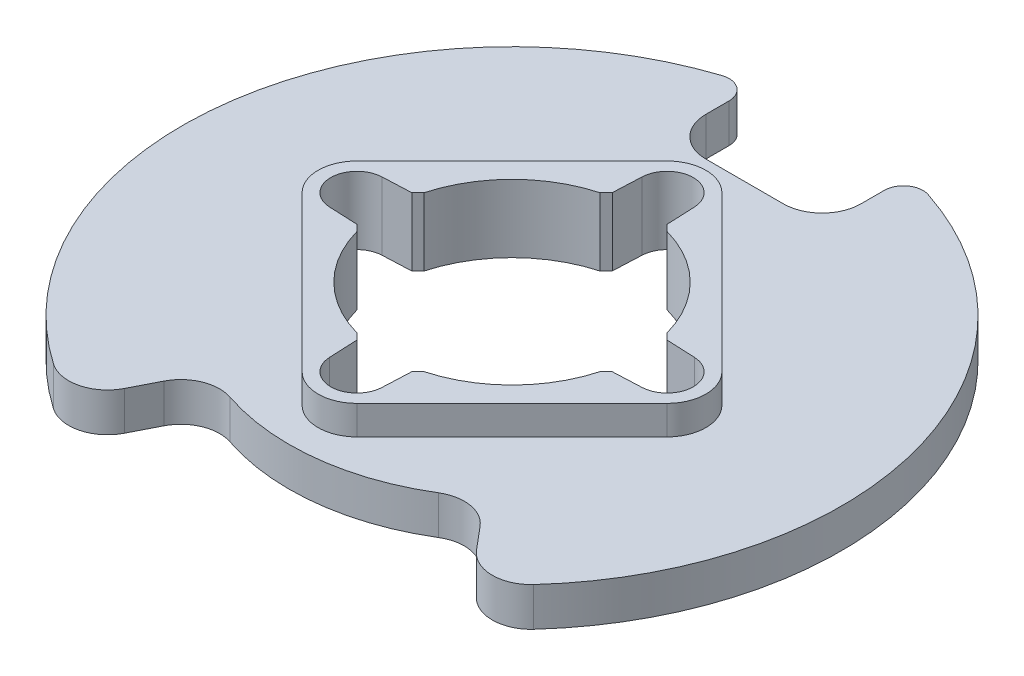
from build123d import *

# Parameters (mm, degrees)
SKETCH_1_R               = 2
SKETCH_1_R_2             = 1.35
EXTRUDE_1_DEPTH          = 1.5
EXTRUDE_1_2_DEPTH        = 1.5
EXTRUDE_1_3_DEPTH        = 1.5
EXTRUDE_1_4_DEPTH        = 1.5
EXTRUDE_3_DEPTH          = 1.5
SKETCH_5_R               = 6.5
CUT_EXTRUDE_1_DEPTH      = 15.221462653
EXTRUDE_START            = 2
SKETCH_4_R               = 17
SKETCH_4_R_2             = 6.5
EXTRUDE_4_DEPTH          = 2
CUT_EXTRUDE_4_DEPTH      = 25.124676164
CUT_EXTRUDE_4_DEPTH_BACK = 25.124676164
SKETCH_8_R               = 1.35
SKETCH_6_W               = 8
SKETCH_6_H               = 5
CUT_EXTRUDE_2_DEPTH      = 25.124676164
CUT_EXTRUDE_3_DEPTH      = 25.124676164
CUT_EXTRUDE_5_DEPTH      = 24.963513933
FILLET_1_R               = 2
FILLET_2_R               = 1


with BuildPart() as part:
    # 草图1 → 凸台-拉伸1 (new body)
    with BuildSketch(Plane(origin=(0, 0, 0), x_dir=(1, 0, 0), z_dir=(0, 1, 0))):
        with Locations(Location((0, 8, 0), (0, 0, 270))):
            Circle(SKETCH_1_R)
        with Locations(Location((0, 8, 0), (0, 0, 270))):
            Circle(SKETCH_1_R_2, mode=Mode.SUBTRACT)
    extrude(amount=EXTRUDE_1_DEPTH)



with BuildPart() as body_2:
    # 草图1 → Extrude 1 2 (new body)
    with BuildSketch(Plane(origin=(0, 0, 0), x_dir=(1, 0, 0), z_dir=(0, 1, 0))):
        with Locations(Location((8, 0, 0), (0, 0, 270))):
            Circle(SKETCH_1_R)
        with Locations(Location((8, 0, 0), (0, 0, 270))):
            Circle(SKETCH_1_R_2, mode=Mode.SUBTRACT)
    extrude(amount=EXTRUDE_1_2_DEPTH)


with BuildPart() as body_3:
    # 草图1 → Extrude 1 3 (new body)
    with BuildSketch(Plane(origin=(0, 0, 0), x_dir=(1, 0, 0), z_dir=(0, 1, 0))):
        with Locations(Location((0, -8, 0), (0, 0, 270))):
            Circle(SKETCH_1_R)
        with Locations(Location((0, -8, 0), (0, 0, 270))):
            Circle(SKETCH_1_R_2, mode=Mode.SUBTRACT)
    extrude(amount=EXTRUDE_1_3_DEPTH)


with BuildPart() as body_4:
    # 草图1 → Extrude 1 4 (new body)
    with BuildSketch(Plane(origin=(0, 0, 0), x_dir=(1, 0, 0), z_dir=(0, 1, 0))):
        with Locations(Location((-8, 0, 0), (0, 0, 270))):
            Circle(SKETCH_1_R)
        with Locations(Location((-8, 0, 0), (0, 0, 270))):
            Circle(SKETCH_1_R_2, mode=Mode.SUBTRACT)
    extrude(amount=EXTRUDE_1_4_DEPTH)


with BuildPart() as part_1:
    add(part.part)

    add(body_2.part)  # 凸台-拉伸3 merges body 2

    add(body_3.part)  # 凸台-拉伸3 merges body 3

    add(body_4.part)  # 凸台-拉伸3 merges body 4
    # 草图3 → 凸台-拉伸3 (add)
    with BuildSketch(Plane.XZ):
        with BuildLine():
            ThreePointArc((-1.414213562, -9.414213562), (-2, -8), (-1.414213562, -6.585786438))
            Line((-1.414213562, -6.585786438), (-6.585786438, -1.414213562))
            ThreePointArc((-6.585786438, -1.414213562), (-8, -2), (-9.414213562, -1.414213562))
            Line((-9.414213562, -1.414213562), (-1.414213562, -9.414213562))
        make_face()
        with BuildLine():
            Line((-1.414213562, 9.414213562), (-9.414213562, 1.414213562))
            ThreePointArc((-9.414213562, 1.414213562), (-8, 2), (-6.585786438, 1.414213562))
            Line((-6.585786438, 1.414213562), (-1.414213562, 6.585786438))
            ThreePointArc((-1.414213562, 6.585786438), (-2, 8), (-1.414213562, 9.414213562))
        make_face()
        with BuildLine():
            ThreePointArc((9.414213562, 1.414213562), (8, 2), (6.585786438, 1.414213562))
            Line((6.585786438, 1.414213562), (1.414213562, 6.585786438))
            ThreePointArc((1.414213562, 6.585786438), (2, 8), (1.414213562, 9.414213562))
            Line((1.414213562, 9.414213562), (9.414213562, 1.414213562))
        make_face()
        with BuildLine():
            ThreePointArc((1.414213562, -9.414213562), (2, -8), (1.414213562, -6.585786438))
            Line((1.414213562, -6.585786438), (6.585786438, -1.414213562))
            ThreePointArc((6.585786438, -1.414213562), (8, -2), (9.414213562, -1.414213562))
            Line((9.414213562, -1.414213562), (1.414213562, -9.414213562))
        make_face()
    extrude(amount=-EXTRUDE_3_DEPTH)

    # 草图5 → 切除-拉伸1 (cut, through all)
    with BuildSketch(Plane.XZ):
        Circle(SKETCH_5_R)
    extrude(amount=-CUT_EXTRUDE_1_DEPTH, mode=Mode.SUBTRACT)

    # 草图4 → 凸台-拉伸4 (add)
    with BuildSketch(Plane.XZ.offset(EXTRUDE_START)):
        with Locations(Location((0, 0, 0), (0, 0, 270))):
            Circle(SKETCH_4_R)
        with Locations(Location((0, 0, 0), (0, 0, 270))):
            Circle(SKETCH_4_R_2, mode=Mode.SUBTRACT)
    extrude(amount=-EXTRUDE_4_DEPTH)

    # 草图8 → 切除-拉伸4 (cut, two sides: drawn at the far end of the back side and taken through both)
    with BuildSketch(Plane(origin=(0, 0, 0), x_dir=(1, 0, 0), z_dir=(0, 1, 0)).offset(-CUT_EXTRUDE_4_DEPTH_BACK)):
        with Locations(Location((8, 0, 0), (0, 0, 270))):
            Circle(SKETCH_8_R)
        with Locations(Location((0, -8, 0), (0, 0, 270))):
            Circle(SKETCH_8_R)
        with Locations(Location((-8, 0, 0), (0, 0, 270))):
            Circle(SKETCH_8_R)
        with Locations(Location((0, 8, 0), (0, 0, 270))):
            Circle(SKETCH_8_R)
    extrude(amount=CUT_EXTRUDE_4_DEPTH + CUT_EXTRUDE_4_DEPTH_BACK, mode=Mode.SUBTRACT)

    # 草图6 → 切除-拉伸2 (cut, through all)
    with BuildSketch(Plane(origin=(0, 0, 0), x_dir=(1, 0, 0), z_dir=(0, 1, 0))):
        with Locations((0, 14.5)):
            Rectangle(SKETCH_6_W, SKETCH_6_H)
    extrude(amount=-CUT_EXTRUDE_2_DEPTH, mode=Mode.SUBTRACT)

    # 草图7 → 切除-拉伸3 (cut, through all)
    with BuildSketch(Plane(origin=(0, 0, 0), x_dir=(1, 0, 0), z_dir=(0, 1, 0))):
        with BuildLine():
            Line((7.392057511, -8.809511096), (10.927389365, -13.022755533))
            ThreePointArc((10.927389365, -13.022755533), (1.924454634, -16.890721547), (-7.717838496, -15.147110911))
            Line((-7.717838496, -15.147110911), (-5.220890747, -10.246575028))
            ThreePointArc((-5.220890747, -10.246575028), (1.301836958, -11.42607634), (7.392057511, -8.809511096))
        make_face()
    extrude(amount=-CUT_EXTRUDE_3_DEPTH, mode=Mode.SUBTRACT)

    # 草图11 → 切除-拉伸5 (cut, through all)
    with BuildSketch(Plane(origin=(0, 1.5, 0), x_dir=(1, 0, 0), z_dir=(0, 1, 0))):
        with BuildLine():
            Line((-8.059965436, 1.348667545), (-6.585786438, 1.414213562))
            Line((-6.585786438, 1.414213562), (-6.263846285, 1.736153715))
            ThreePointArc((-6.263846285, 1.736153715), (-4.596194078, 4.596194078), (-1.736153715, 6.263846285))
            Line((-1.736153715, 6.263846285), (-1.414213562, 6.585786438))
            Line((-1.414213562, 6.585786438), (-1.348667545, 8.059965436))
            ThreePointArc((-1.348667545, 8.059965436), (0, 9.35), (1.348667545, 8.059965436))
            Line((1.348667545, 8.059965436), (1.414213562, 6.585786438))
            Line((1.414213562, 6.585786438), (1.736153715, 6.263846285))
            ThreePointArc((1.736153715, 6.263846285), (4.596194078, 4.596194078), (6.263846285, 1.736153715))
            Line((6.263846285, 1.736153715), (6.585786438, 1.414213562))
            Line((6.585786438, 1.414213562), (8.059965436, 1.348667545))
            ThreePointArc((8.059965436, 1.348667545), (9.35, 0), (8.059965436, -1.348667545))
            Line((8.059965436, -1.348667545), (6.585786438, -1.414213562))
            Line((6.585786438, -1.414213562), (6.263846285, -1.736153715))
            ThreePointArc((6.263846285, -1.736153715), (4.596194078, -4.596194078), (1.736153715, -6.263846285))
            Line((1.736153715, -6.263846285), (1.414213562, -6.585786438))
            Line((1.414213562, -6.585786438), (1.348667545, -8.059965436))
            ThreePointArc((1.348667545, -8.059965436), (0, -9.35), (-1.348667545, -8.059965436))
            Line((-1.348667545, -8.059965436), (-1.414213562, -6.585786438))
            Line((-1.414213562, -6.585786438), (-1.736153715, -6.263846285))
            ThreePointArc((-1.736153715, -6.263846285), (-4.596194078, -4.596194078), (-6.263846285, -1.736153715))
            Line((-6.263846285, -1.736153715), (-6.585786438, -1.414213562))
            Line((-6.585786438, -1.414213562), (-8.059965436, -1.348667545))
            ThreePointArc((-8.059965436, -1.348667545), (-9.35, 0), (-8.059965436, 1.348667545))
        make_face()
    extrude(amount=-CUT_EXTRUDE_5_DEPTH, mode=Mode.SUBTRACT)

    # 圆角1
    fillet_1_edges = [part_1.edges().sort_by_distance(p)[0] for p in [
        (-4, -1, -12),
        (4, -1, -12),
        (-5.220890747, -1, 10.246575028),
        (7.392057511, -1, 8.809511096),
        (10.927389365, -1, 13.022755533),
        (-7.717838496, -1, 15.147110911),
    ]]
    fillet(fillet_1_edges, radius=FILLET_1_R)

    # 圆角2
    fillet_2_edges = [part_1.edges().sort_by_distance(p)[0] for p in [
        (4, -1, -16.522711642),
        (-4, -1, -16.522711642),
    ]]
    fillet(fillet_2_edges, radius=FILLET_2_R)


solid = part_1.part
